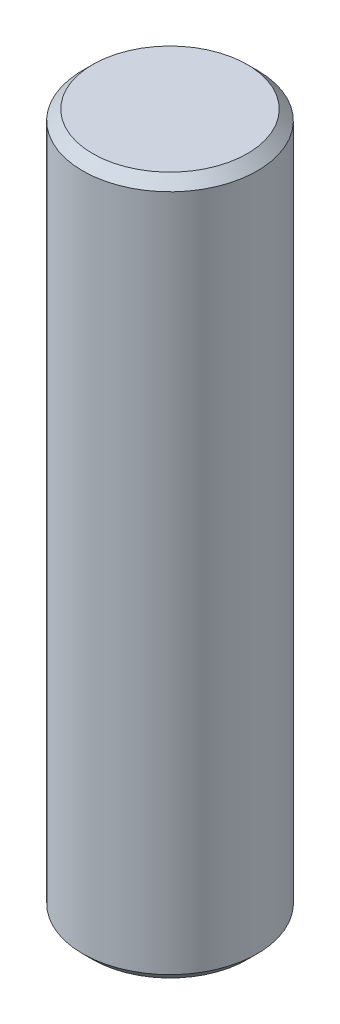
from build123d import *

# Parameters (mm, degrees)
SKETCH_1_R      = 1.75
EXTRUDE_1_DEPTH = 14
CHAMFER_1_SIZE  = 0.2


with BuildPart() as part:
    # 草图1 → 凸台-拉伸1 (new body)
    with BuildSketch(Plane(origin=(0, 0, 0), x_dir=(1, 0, 0), z_dir=(0, 1, 0))):
        with Locations(Location((0, 0, 0), (0, 0, 270))):
            Circle(SKETCH_1_R)
    extrude(amount=EXTRUDE_1_DEPTH)

    # 倒角1
    chamfer_1_edges = [part.edges().sort_by_distance(p)[0] for p in [
        (0, 0, -1.75),
        (0, 14, -1.75),
    ]]
    chamfer(chamfer_1_edges, length=CHAMFER_1_SIZE)


solid = part.part
